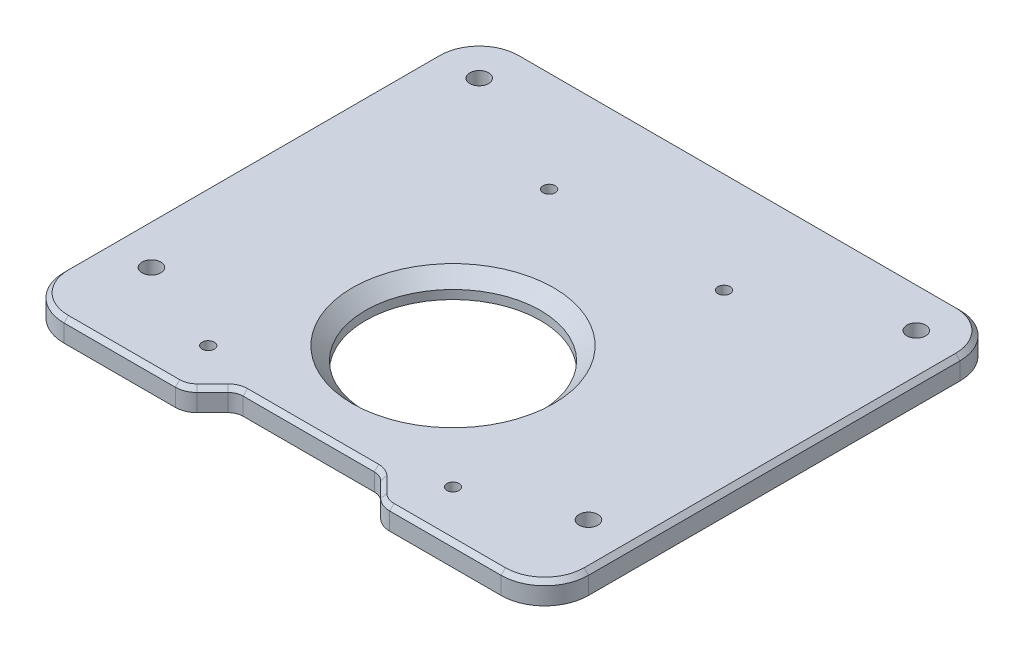
from build123d import *

# Parameters (mm, degrees)
SKETCH2_W           = 120
SKETCH2_H           = 105
SKETCH2_R           = 1.4
BOSS_EXTRUDE2_DEPTH = 5
CUT_EXTRUDE7_DEPTH  = 90.336442732
FILLET5_R           = 10
SKETCH10_R          = 20
CUT_EXTRUDE9_DEPTH  = 90.336442732
CHAMFER3_SIZE       = 3
FILLET6_R           = 5
CHAMFER4_SIZE       = 1
SKETCH11_R          = 2.15
CUT_EXTRUDE10_DEPTH = 90.336442732
SKETCH13_R          = 3.25
CUT_EXTRUDE12_DEPTH = 2.5


with BuildPart() as part:
    # Sketch2 → Boss-Extrude2 (new body)
    with BuildSketch(Plane(origin=(0, 0, 0), x_dir=(1, 0, 0), z_dir=(0, 1, 0))):
        with Locations((0, 13.5)):
            Rectangle(SKETCH2_W, SKETCH2_H)
        with Locations(Location((-28, -28, 0), (0, 0, 270))):
            Circle(SKETCH2_R, mode=Mode.SUBTRACT)
        with Locations(Location((28, -28, 0), (0, 0, 270))):
            Circle(SKETCH2_R, mode=Mode.SUBTRACT)
        with Locations(Location((20, 42, 0), (0, 0, 270))):
            Circle(SKETCH2_R, mode=Mode.SUBTRACT)
        with Locations(Location((-20, 42, 0), (0, 0, 270))):
            Circle(SKETCH2_R, mode=Mode.SUBTRACT)
    extrude(amount=BOSS_EXTRUDE2_DEPTH)

    # Sketch9 → Cut-Extrude7 (cut, through all)
    with BuildSketch(Plane(origin=(0, 5, 0), x_dir=(1, 0, 0), z_dir=(0, 1, 0))):
        with BuildLine():
            Line((-17.474873734, -34.025126266), (-23.449747468, -40))
            Line((-23.449747468, -40), (23.449747468, -40))
            Line((23.449747468, -40), (17.474873734, -34.025126266))
            ThreePointArc((17.474873734, -34.025126266), (16.339392013, -33.266421636), (15, -33))
            Line((15, -33), (-15, -33))
            ThreePointArc((-15, -33), (-16.339392013, -33.266421636), (-17.474873734, -34.025126266))
        make_face()
    extrude(amount=-CUT_EXTRUDE7_DEPTH, mode=Mode.SUBTRACT)

    # Fillet5
    fillet5_edges = [part.edges().sort_by_distance(p)[0] for p in [
        (-60, 2.5, -66),
        (60, 2.5, -66),
        (60, 2.5, 39),
        (-60, 2.5, 39),
    ]]
    fillet(fillet5_edges, radius=FILLET5_R)

    # Sketch10 → Cut-Extrude9 (cut, through all)
    with BuildSketch(Plane(origin=(0, 0, 0), x_dir=(1, 0, 0), z_dir=(0, 1, 0))):
        with Locations(Location((0, 0, 0), (0, 0, 270))):
            Circle(SKETCH10_R)
    extrude(amount=CUT_EXTRUDE9_DEPTH, mode=Mode.SUBTRACT)

    # Chamfer3
    chamfer3_edges = [part.edges().sort_by_distance(p)[0] for p in [
        (0, 5, -20),
    ]]
    chamfer(chamfer3_edges, length=CHAMFER3_SIZE)

    # Fillet6
    fillet6_edges = [part.edges().sort_by_distance(p)[0] for p in [
        (-22.449747468, 2.5, 39),
        (22.449747468, 2.5, 39),
    ]]
    fillet(fillet6_edges, radius=FILLET6_R)

    # Chamfer4
    chamfer4_edges = [part.edges().sort_by_distance(p)[0] for p in [
        (16.339392013, 5, 33.266421636),
        (0, 5, 33),
        (-16.339392013, 5, 33.266421636),
        (-19.230077554, 5, 35.780330086),
        (-60, 5, -13.5),
        (0, 5, -66),
        (60, 5, -13.5),
        (-37.26040764, 5, 39),
        (-57.071067812, 5, 36.071067812),
        (57.071067812, 5, 36.071067812),
        (57.071067812, 5, -63.071067812),
        (-57.071067812, 5, -63.071067812),
        (19.230077554, 5, 35.780330086),
        (37.26040764, 5, 39),
        (22.607398118, 5, 38.619397663),
        (-22.607398118, 5, 38.619397663),
    ]]
    chamfer(chamfer4_edges, length=CHAMFER4_SIZE)

    # Sketch11 → Cut-Extrude10 (cut, through all)
    with BuildSketch(Plane(origin=(0, 5, 0), x_dir=(1, 0, 0), z_dir=(0, 1, 0))):
        with Locations(Location((-50, 56, 0), (0, 0, 270))):
            Circle(SKETCH11_R)
        with Locations(Location((50, 56, 0), (0, 0, 270))):
            Circle(SKETCH11_R)
        with Locations(Location((-50, -19, 0), (0, 0, 270))):
            Circle(SKETCH11_R)
        with Locations(Location((50, -19, 0), (0, 0, 270))):
            Circle(SKETCH11_R)
    extrude(amount=-CUT_EXTRUDE10_DEPTH, mode=Mode.SUBTRACT)

    # Sketch13 → Cut-Extrude12 (cut)
    with BuildSketch(Plane.XZ):
        with Locations(Location((-28, 28, 0), (0, 0, 270))):
            Circle(SKETCH13_R)
        with Locations(Location((28, 28, 0), (0, 0, 270))):
            Circle(SKETCH13_R)
        with Locations(Location((-20, -42, 0), (0, 0, 270))):
            Circle(SKETCH13_R)
        with Locations(Location((20, -42, 0), (0, 0, 270))):
            Circle(SKETCH13_R)
    extrude(amount=-CUT_EXTRUDE12_DEPTH, mode=Mode.SUBTRACT)


solid = part.part
